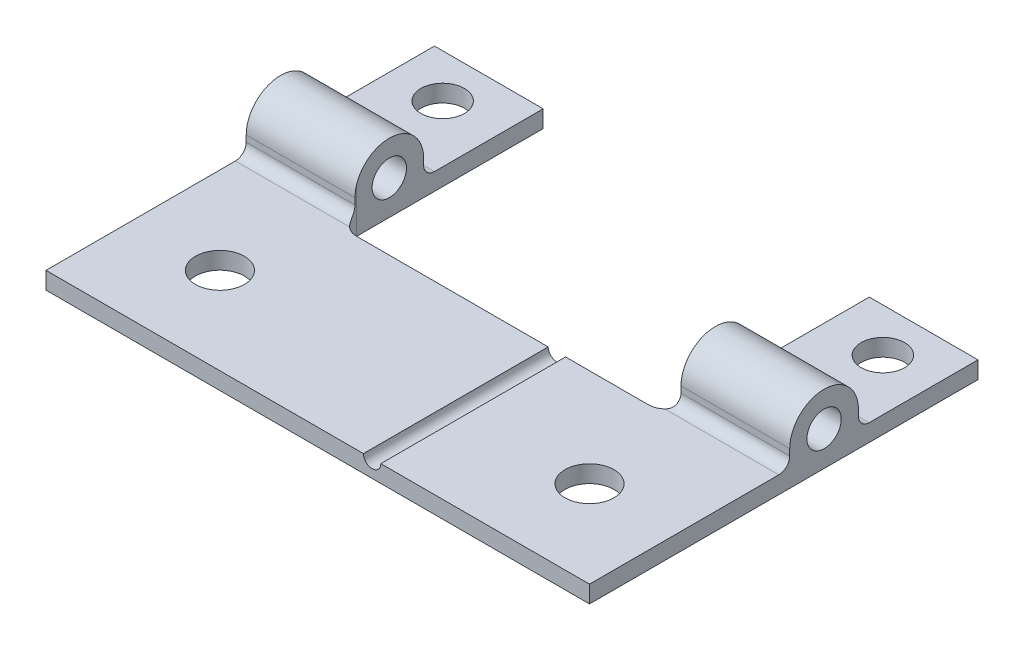
from build123d import *

# Parameters (mm, degrees)
SKETCH1_W                     = 25
SKETCH1_H                     = 10
BASE_PLATE_DEPTH              = 0.79
PINHOLDER_DEPTH               = 5
SKETCH4_R                     = 0.79
PIN_SHAFT_DEPTH               = 30.913269547
SKETCH5_R                     = 1.125
SCREW_HOLES_DEPTH             = 4
SKETCH11_R                    = 1
SET_SCREW_HOLE_DEPTH          = 1.5
MIRRORED_FILLETS_R            = 0.5
MIRRORED_FILLETS_OF_MIRROR1_R = 0.5
SPRING_GROOVE_DEPTH           = 1.5
FILLET2_R                     = 0.79
SKETCH9_R                     = 0.4


with BuildPart() as part:
    # Sketch1 → Base Plate (new body)
    with BuildSketch(Plane(origin=(0, 0, 0), x_dir=(1, 0, 0), z_dir=(0, 1, 0))):
        with Locations((1.323198198, 3.248873874)):
            Rectangle(SKETCH1_W, SKETCH1_H)
    extrude(amount=BASE_PLATE_DEPTH)

    # Sketch2 → PinHolder (add)
    with BuildSketch(Plane.ZY.offset(11.176801802)):
        with BuildLine():
            Line((-8.248873874, 0), (-8.248873874, 0.79))
            Line((-8.248873874, 0.79), (-7.458873874, 0.79))
            Line((-7.458873874, 0.79), (-7.458873874, 1.58))
            ThreePointArc((-7.458873874, 1.58), (-9.038873874, 3.16), (-10.618873874, 1.58))
            Line((-10.618873874, 1.58), (-10.618873874, 1.29))
            ThreePointArc((-10.618873874, 1.29), (-10.765320483, 0.936446609), (-11.118873874, 0.79))
            Line((-11.118873874, 0.79), (-16.118873874, 0.79))
            Line((-16.118873874, 0.79), (-16.118873874, 0))
            Line((-16.118873874, 0), (-11.426644498, 0))
            Line((-11.426644498, 0), (-8.248873874, 0))
        make_face()
    pinholder = extrude(amount=-PINHOLDER_DEPTH)

    # Sketch4 → Pin Shaft (cut, through all)
    with BuildSketch(Plane.ZY.offset(11.176801802)):
        with Locations((-9.038873874, 1.58)):
            Circle(SKETCH4_R)
    pin_shaft = extrude(amount=-PIN_SHAFT_DEPTH, mode=Mode.SUBTRACT)

    # Sketch5 → Screw Holes (cut)
    with BuildSketch(Plane(origin=(0, 0.79, 0), x_dir=(1, 0, 0), z_dir=(0, 1, 0))):
        with Locations(Location((-7.176801802, 2.248873874, 0), (0, 0, 270))):
            Circle(SKETCH5_R)
        with Locations(Location((9.823198198, 2.248873874, 0), (0, 0, 270))):
            Circle(SKETCH5_R)
    extrude(amount=-SCREW_HOLES_DEPTH, mode=Mode.SUBTRACT)

    # Sketch11 → Set Screw Hole (cut)
    with BuildSketch(Plane(origin=(0, 0.79, 0), x_dir=(1, 0, 0), z_dir=(0, 1, 0))):
        with Locations(Location((-8.801801802, 14.118873874, 0), (0, 0, 270))):
            Circle(SKETCH11_R)
    set_screw_hole = extrude(amount=-SET_SCREW_HOLE_DEPTH, mode=Mode.SUBTRACT)

    # Mirrored Fillets
    mirrored_fillets_edges = [part.edges().sort_by_distance(p)[0] for p in [
        (-8.676801802, 0.79, -7.458873874),
    ]]
    fillet(mirrored_fillets_edges, radius=MIRRORED_FILLETS_R)

    # Mirror1: PinHolder, Pin Shaft, Set Screw Hole across plane
    add(pinholder.mirror(Plane(origin=(1.323198198, 0, 0), x_dir=(0, 0, 1), z_dir=(1, 0, 0))))
    add(pin_shaft.mirror(Plane(origin=(1.323198198, 0, 0), x_dir=(0, 0, 1), z_dir=(1, 0, 0))), mode=Mode.SUBTRACT)
    add(set_screw_hole.mirror(Plane(origin=(1.323198198, 0, 0), x_dir=(0, 0, 1), z_dir=(1, 0, 0))), mode=Mode.SUBTRACT)

    # Mirrored Fillets of Mirror1
    mirrored_fillets_of_mirror1_edges = [part.edges().sort_by_distance(p)[0] for p in [
        (11.323198198, 0.79, -7.458873874),
    ]]
    fillet(mirrored_fillets_of_mirror1_edges, radius=MIRRORED_FILLETS_OF_MIRROR1_R)

    # Sketch10 → Spring Groove (cut)
    with BuildSketch(Plane(origin=(0, 0, -8.248873874), x_dir=(-1, 0, 0), z_dir=(0, 0, -1))):
        Polygon((-3.823198198, 0.79), (1.176801802, 0.79), (6.176801802, 0.79), (6.176801802, 0), (1.176801802, 0), (-3.823198198, 0), (-8.823198198, 0), (-8.823198198, 0.79), align=None)
    extrude(amount=-SPRING_GROOVE_DEPTH, mode=Mode.SUBTRACT)

    # Fillet2
    fillet2_edges = [part.edges().sort_by_distance(p)[0] for p in [
        (-6.176801802, 0.395, -6.748873874),
        (8.823198198, 0.395, -6.748873874),
    ]]
    fillet(fillet2_edges, radius=FILLET2_R)

    # Wire Groove: sweep along a path in Sketch8
    with BuildLine(Plane.XZ.offset(-0.79)) as wire_groove_path:
        Line((3.823198198, -8.248873874), (3.823198198, 1.751126126))
    # Sketch9 → Wire Groove (sweep, cut)
    with BuildSketch(Plane.XY.offset(1.751126126)):
        with Locations((3.823198198, 0.79)):
            Circle(SKETCH9_R)
    sweep(path=wire_groove_path.line, mode=Mode.SUBTRACT)


solid = part.part
